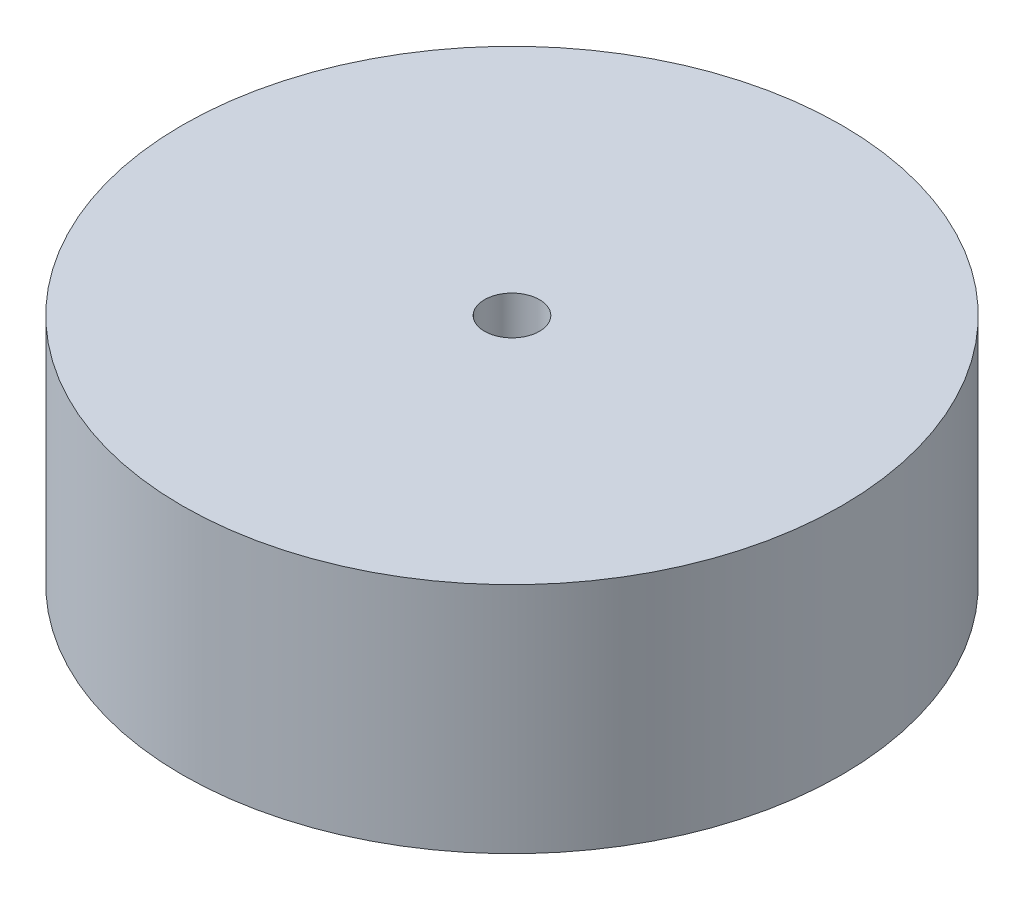
from build123d import *

# Parameters (mm, degrees)
SKETCH3_R                  = 38.1
BOSS_EXTRUDE1_DEPTH        = 26.924
F_1_4_0_2500_DOWEL_HOLE2_D = 6.35


with BuildPart() as part:
    # Sketch3 → Boss-Extrude1 (new body)
    with BuildSketch(Plane(origin=(0, 0, 0), x_dir=(1, 0, 0), z_dir=(0, 1, 0))):
        with Locations(Location((0, 0, 0), (0, 0, 270))):
            Circle(SKETCH3_R)
    extrude(amount=BOSS_EXTRUDE1_DEPTH)

    # 1/4 (0.2500) Dowel Hole2 (through all)
    with Locations(Plane(origin=(0, 26.924, 0), x_dir=(1, 0, 0), z_dir=(0, 1, 0))):
        with Locations((0, 0)):
            Hole(F_1_4_0_2500_DOWEL_HOLE2_D / 2)


solid = part.part
